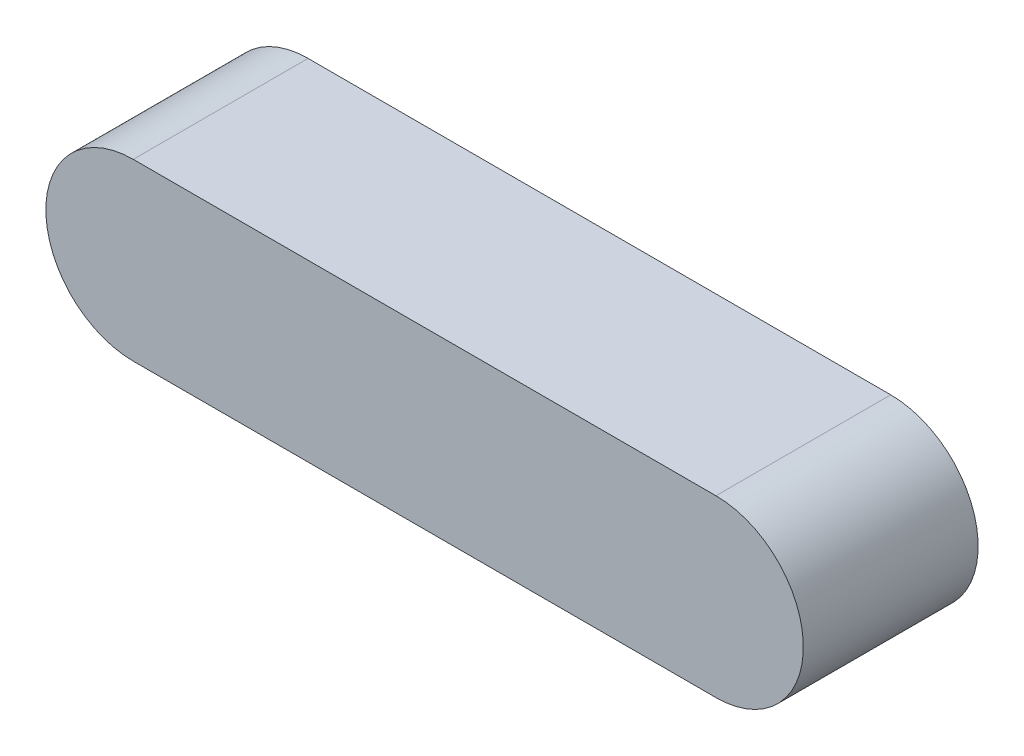
from build123d import *

# Parameters (mm, degrees)
EXTRUSION1_DEPTH = 3


with BuildPart() as part:
    # Esquisse2 → Extrusion1 (new body)
    with BuildSketch(Plane.XY):
        with BuildLine():
            Line((48, 1.5), (58, 1.5))
            ThreePointArc((58, 1.5), (59.5, 0), (58, -1.5))
            Line((58, -1.5), (48, -1.5))
            ThreePointArc((48, -1.5), (46.5, 0), (48, 1.5))
        make_face()
    extrude(amount=EXTRUSION1_DEPTH)


solid = part.part
